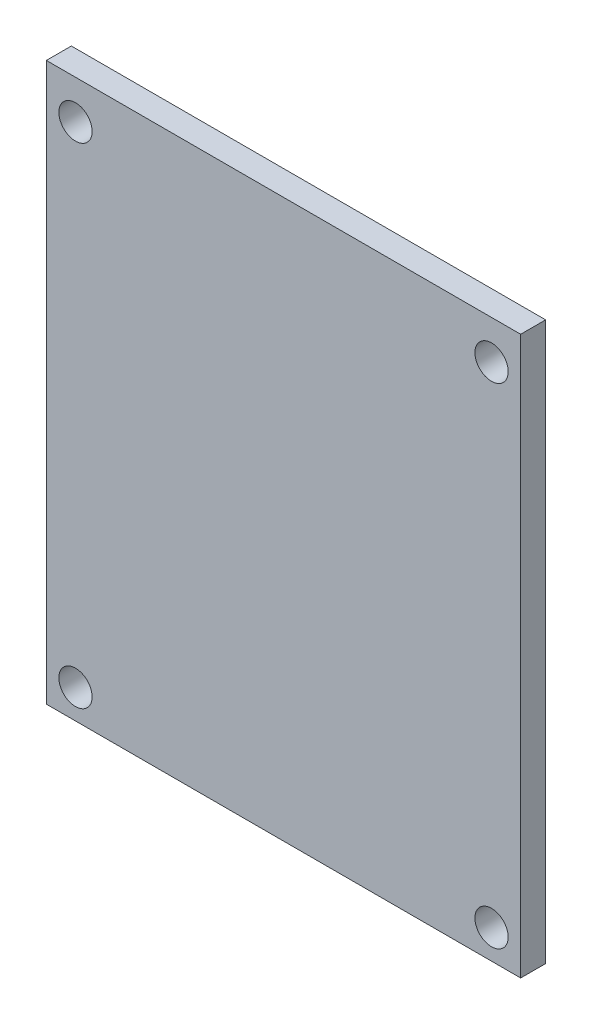
from build123d import *

# Parameters (mm, degrees)
SKICA1_W                = 57
SKICA1_H                = 67
SKICA1_R                = 2
P_IDAT_VYSUNUT_M1_DEPTH = 3
P_IDAT_VYSUNUT_M2_DEPTH = 1


with BuildPart() as part:
    # Skica1 → Přidat vysunutím1 (new body)
    with BuildSketch(Plane.XY):
        with Locations((28.5, 33.5)):
            Rectangle(SKICA1_W, SKICA1_H)
        with Locations((3.5, 62.35016579)):
            Circle(SKICA1_R, mode=Mode.SUBTRACT)
        with Locations((53.5, 62.35016579)):
            Circle(SKICA1_R, mode=Mode.SUBTRACT)
        with Locations((53.5, 3.5)):
            Circle(SKICA1_R, mode=Mode.SUBTRACT)
        with Locations((3.5, 3.5)):
            Circle(SKICA1_R, mode=Mode.SUBTRACT)
    extrude(amount=P_IDAT_VYSUNUT_M1_DEPTH)

    # Skica2 → Přidat vysunutím2 (add)
    with BuildSketch(Plane(origin=(0, 0, 0), x_dir=(-1, 0, 0), z_dir=(0, 0, -1))):
        Polygon((-41.396588298, 31.388427372), (-41.396588298, 33.183299167), (-23.447870349, 33.183299167), (-23.447870349, 40.87560686), (-21.396588298, 40.87560686), (-21.396588298, 31.388427372), align=None)
    extrude(amount=P_IDAT_VYSUNUT_M2_DEPTH)


solid = part.part
